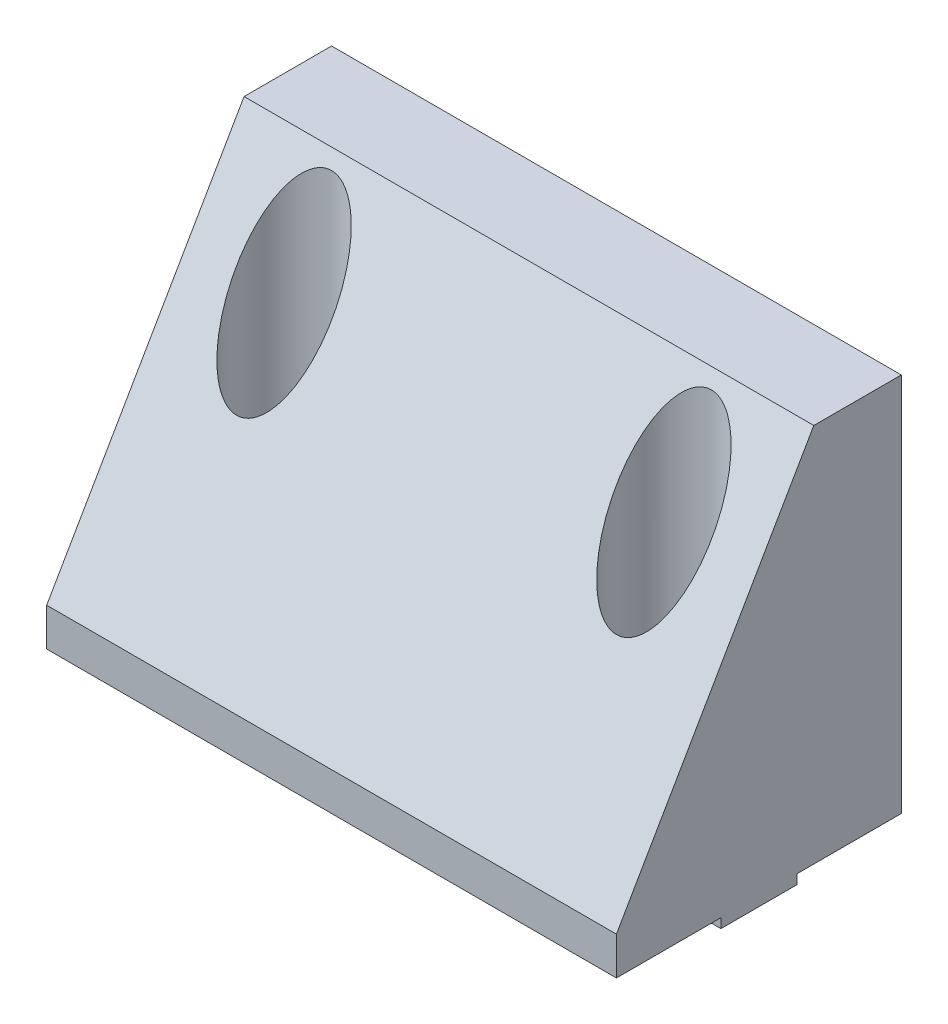
from build123d import *

# Parameters (mm, degrees)
BOSS_EXTRUDE1_DEPTH = 30
SKETCH2_R           = 2.25
CUT_EXTRUDE1_DEPTH  = 53.201532545
CUT_EXTRUDE2_START  = -13
SKETCH3_R           = 5
CUT_EXTRUDE2_DEPTH  = 40.201532545
BOSS_EXTRUDE2_START = 1
SKETCH4_W           = 60
SKETCH4_H           = 8
SKETCH4_R           = 2.25
BOSS_EXTRUDE2_DEPTH = 1


with BuildPart() as part:
    # Sketch1 → Boss-Extrude1 (new, symmetric)
    with BuildSketch(Plane(origin=(0, 0, 0), x_dir=(0, 0, -1), z_dir=(1, 0, 0))):
        Polygon((-15, 0), (15, 0), (15, 40), (5.784609691, 40), (-15, 4), align=None)
    extrude(amount=BOSS_EXTRUDE1_DEPTH, both=True)

    # Sketch2 → Cut-Extrude1 (cut, through all)
    with BuildSketch(Plane.XZ):
        with Locations(Location((-20, 0, 0), (0, 0, 270))):
            Circle(SKETCH2_R)
        with Locations(Location((20, 0, 0), (0, 0, 270))):
            Circle(SKETCH2_R)
    extrude(amount=-CUT_EXTRUDE1_DEPTH, mode=Mode.SUBTRACT)

    # Sketch3 → Cut-Extrude2 (cut, through all)
    with BuildSketch(Plane.XZ.offset(CUT_EXTRUDE2_START)):
        with Locations(Location((-20, 0, 0), (0, 0, 270))):
            Circle(SKETCH3_R)
        with Locations(Location((20, 0, 0), (0, 0, 270))):
            Circle(SKETCH3_R)
    extrude(amount=-CUT_EXTRUDE2_DEPTH, mode=Mode.SUBTRACT)

    # Sketch4 → Boss-Extrude2 (add)
    with BuildSketch(Plane.XZ.offset(BOSS_EXTRUDE2_START)):
        Rectangle(SKETCH4_W, SKETCH4_H)
        with Locations(Location((-20, 0, 0), (0, 0, 270))):
            Circle(SKETCH4_R, mode=Mode.SUBTRACT)
        with Locations(Location((20, 0, 0), (0, 0, 270))):
            Circle(SKETCH4_R, mode=Mode.SUBTRACT)
    extrude(amount=-BOSS_EXTRUDE2_DEPTH)


solid = part.part
